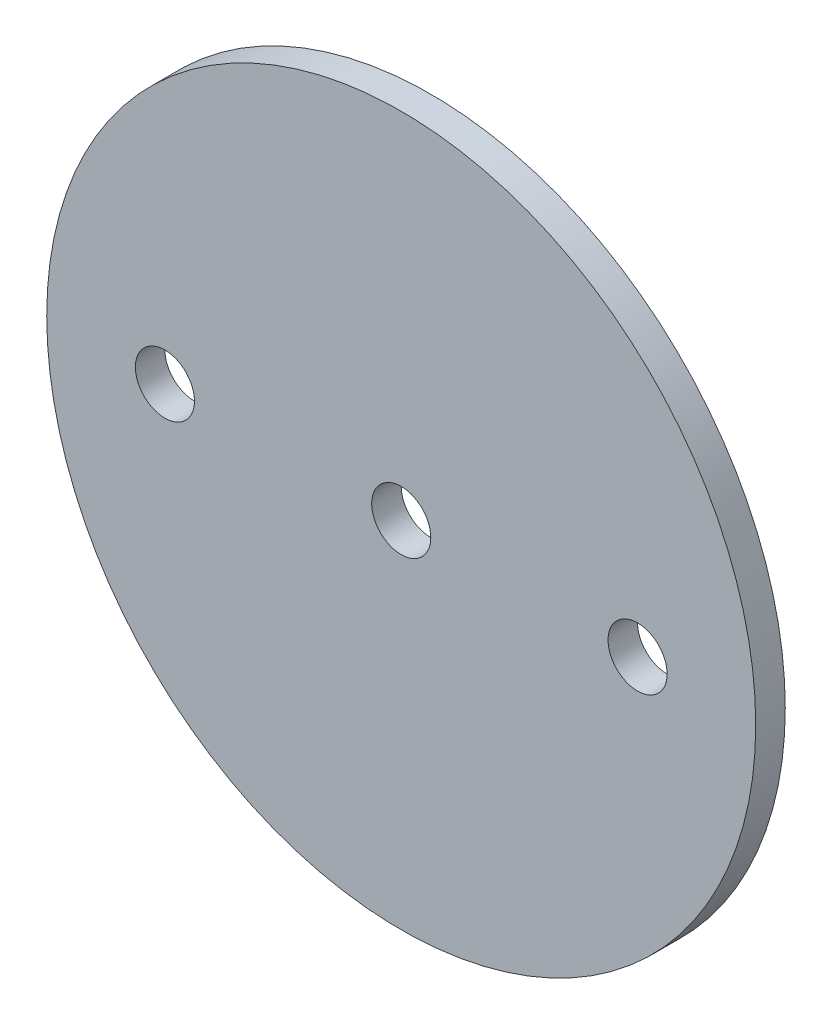
from build123d import *

# Parameters (mm, degrees)
SKETCH1_R                   = 38.1
BOSS_EXTRUDE1_DEPTH         = 1.5875
F_1_4_0_25_DIAMETER_HOLE1_D = 6.35


with BuildPart() as part:
    # Sketch1 → Boss-Extrude1 (new, symmetric)
    with BuildSketch(Plane.XY):
        Circle(SKETCH1_R)
    extrude(amount=BOSS_EXTRUDE1_DEPTH, both=True)

    # 1/4 (0.25) Diameter Hole1 (through all)
    with Locations(Plane.XY.offset(1.5875)):
        with Locations((-25.4, 0), (0, 0), (25.4, 0)):
            Hole(F_1_4_0_25_DIAMETER_HOLE1_D / 2)


solid = part.part
